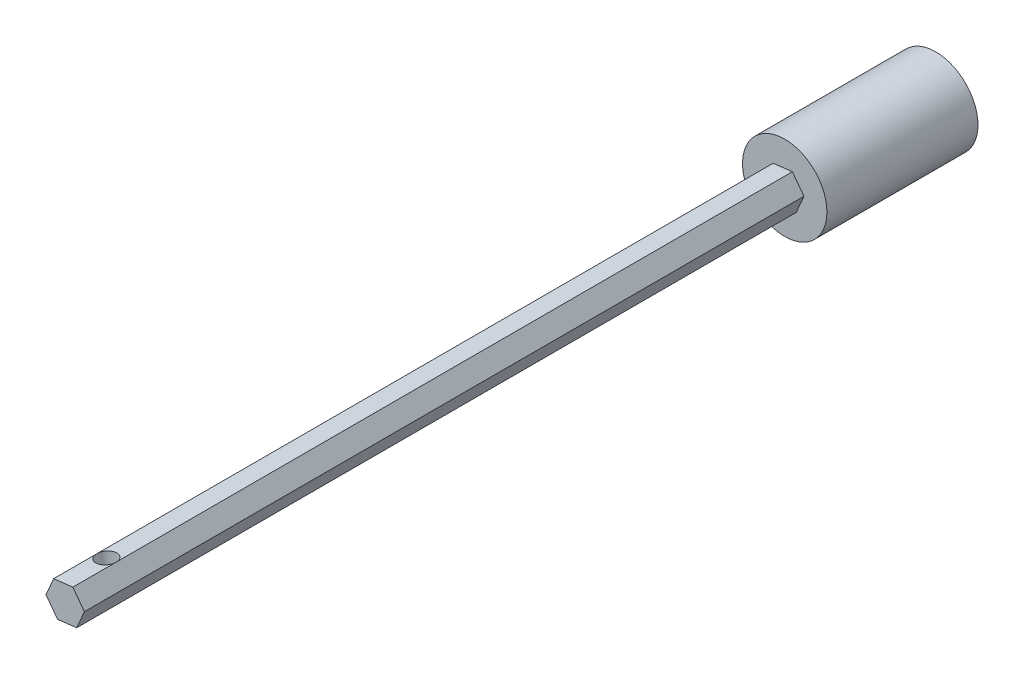
from build123d import *

# Parameters (mm, degrees)
BOSS_EXTRUDE1_DEPTH = 660.4
SKETCH2_RX          = 7.33298
SKETCH2_RY          = 7.27642549
CUT_EXTRUDE1_DEPTH  = 33.02
SKETCH3_R           = 32.004
BOSS_EXTRUDE2_DEPTH = 114.6048


with BuildPart() as part:
    # Sketch1 → Boss-Extrude1 (new body)
    with BuildSketch(Plane.XY):
        Polygon((5.802204234, 13.469402687), (-8.763742784, 11.759557608), (-14.565947018, -1.709845079), (-5.802204234, -13.469402687), (8.763742784, -11.759557608), (14.565947018, 1.709845079), align=None)
    extrude(amount=BOSS_EXTRUDE1_DEPTH)

    # Sketch2 → Cut-Extrude1 (cut)
    with BuildSketch(Plane(origin=(-1.480769275, 12.614480148, 0), x_dir=(0.9931806044692795, 0.11658596358926146, 0), z_dir=(-0.11658596358926147, 0.9931806044692796, 0))):
        with Locations(Location((0, -627.66702), (0, 0, 180))):
            Ellipse(SKETCH2_RX, SKETCH2_RY)
    extrude(amount=-CUT_EXTRUDE1_DEPTH, mode=Mode.SUBTRACT)

    # Sketch3 → Boss-Extrude2 (add)
    with BuildSketch(Plane.XY):
        Circle(SKETCH3_R)
    extrude(amount=BOSS_EXTRUDE2_DEPTH)


solid = part.part
